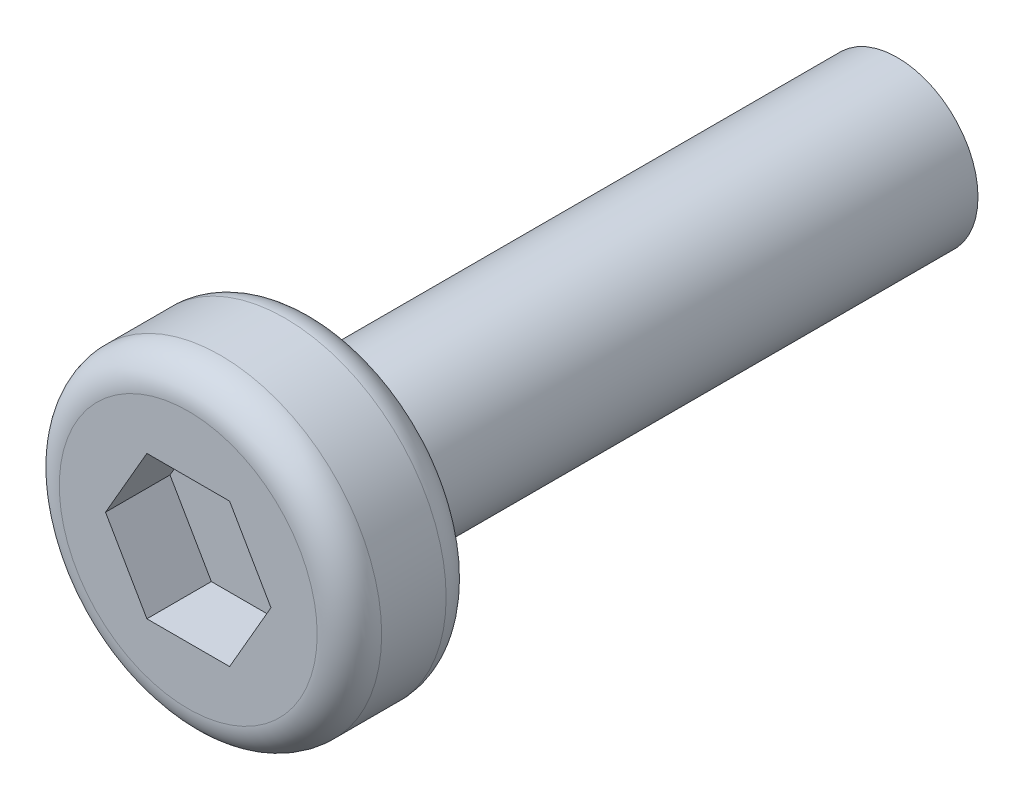
from build123d import *

# Parameters (mm, degrees)
SKETCH1_R           = 1.25
BOSS_EXTRUDE1_DEPTH = 9
SKETCH2_R           = 2.5
BOSS_EXTRUDE2_DEPTH = 2
CUT_EXTRUDE1_DEPTH  = 1
FILLET1_R           = 0.5


with BuildPart() as part:
    # Sketch1 → Boss-Extrude1 (new body)
    with BuildSketch(Plane.XY):
        Circle(SKETCH1_R)
    extrude(amount=-BOSS_EXTRUDE1_DEPTH)

    # Sketch2 → Boss-Extrude2 (add)
    with BuildSketch(Plane.XY):
        Circle(SKETCH2_R)
    extrude(amount=BOSS_EXTRUDE2_DEPTH)

    # Sketch3 → Cut-Extrude1 (cut)
    with BuildSketch(Plane.XY.offset(2)):
        Polygon((1.283002505, 0), (0.641501252, 1.111112762), (-0.641501252, 1.111112762), (-1.283002505, 0), (-0.641501252, -1.111112762), (0.641501252, -1.111112762), align=None)
    extrude(amount=-CUT_EXTRUDE1_DEPTH, mode=Mode.SUBTRACT)

    # Fillet1
    fillet1_edges = [part.edges().sort_by_distance(p)[0] for p in [
        (-2.5, 0, 0),
        (-2.5, 0, 2),
    ]]
    fillet(fillet1_edges, radius=FILLET1_R)


solid = part.part
